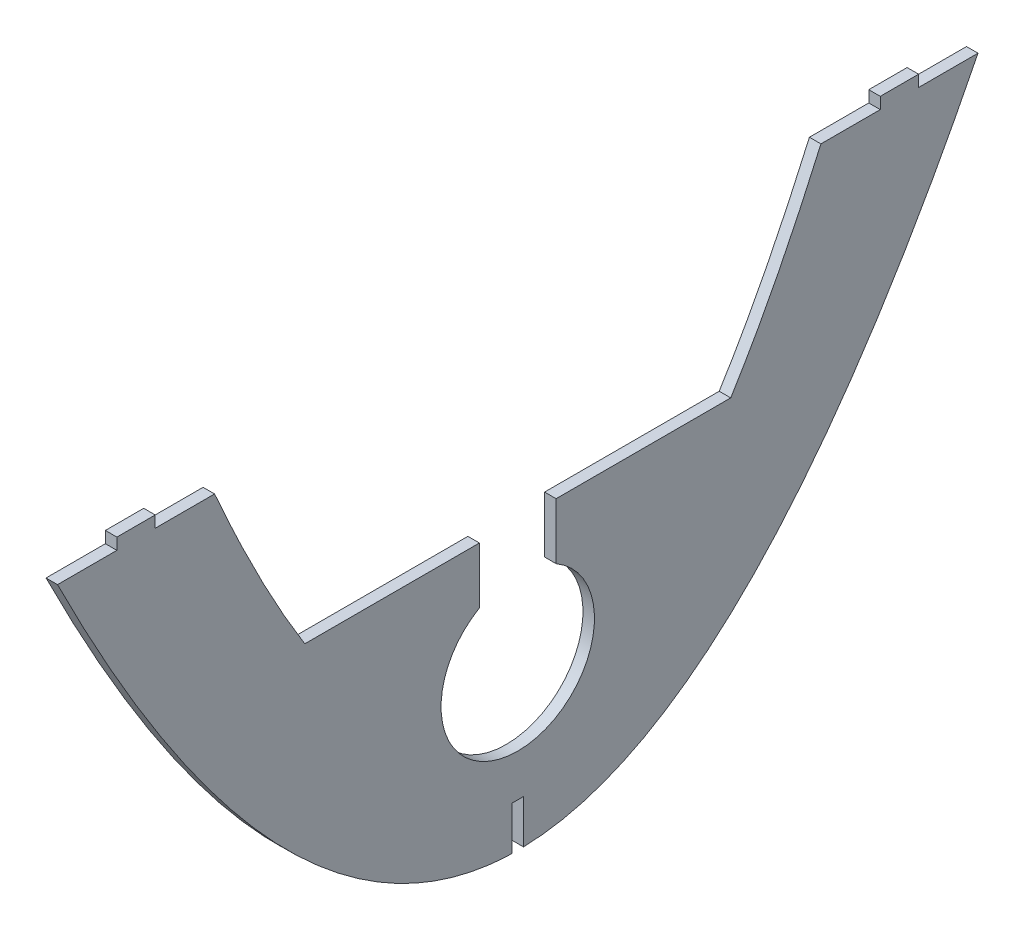
from build123d import *
from build123d.topology import SkipClean

# Parameters (mm, degrees)
EXTRUDE_1_DEPTH          = 3
SKETCH_2_W               = 3
SKETCH_2_H               = 10
EXTRUDE_2_DEPTH          = 3
EXTRUDE_3_DEPTH          = 3
CUT_EXTRUDE_1_DEPTH      = 172.862791995
CUT_EXTRUDE_1_DEPTH_BACK = 3
SKETCH_4_W               = 3
SKETCH_4_H               = 15.330567524
CUT_EXTRUDE_2_DEPTH      = 172.862791995


with BuildPart() as part:
    # 草图1 → 凸台-拉伸1 (new body)
    with BuildSketch(Plane(origin=(0, 0, 0), x_dir=(0, 0, -1), z_dir=(1, 0, 0))):
        with BuildLine():
            Line((-120, 119.995200001), (-79.04385574, 119.995200001))
            add(Edge.make_bspline(
                [(-79.04385574, 119.995200001), (0, -59.995200001), (79.04385574, 119.995200001)],
                knots=[0.203375214, 0.203375214, 0.203375214, 0.796624786, 0.796624786, 0.796624786], degree=2))
            Line((79.04385574, 119.995200001), (120, 119.995200001))
            add(Edge.make_bspline(
                [(-120, 119.995200001), (0, -119.995200001), (120, 119.995200001)],
                knots=[0.056028977, 0.056028977, 0.056028977, 0.943971023, 0.943971023, 0.943971023], degree=2))
        make_face()
    extrude(amount=EXTRUDE_1_DEPTH)

    # 草图2 → 凸台-拉伸2 (add)
    with BuildSketch(Plane(origin=(0, 119.995200001, 0), x_dir=(1, 0, 0), z_dir=(0, 1, 0))):
        with Locations((1.5, -99.52192787)):
            Rectangle(SKETCH_2_W, SKETCH_2_H)
        with Locations((1.5, 99.52192787)):
            Rectangle(SKETCH_2_W, SKETCH_2_H)
    extrude(amount=EXTRUDE_2_DEPTH)

    # 草图3 → 凸台-拉伸3 (add)
    with BuildSketch(Plane(origin=(3, 0, 0), x_dir=(0, 0, -1), z_dir=(1, 0, 0))):
        with BuildLine():
            ThreePointArc((10, 59.720508076), (18.900244528, 48.940700022), (18.566840065, 34.96545563))
            add(Edge.make_bspline(
                [(55.520060246, 74.4), (37.043450156, 44.848105266), (18.566840065, 34.96545563)],
                knots=[0, 0, 0, 1, 1, 1], degree=2))
            Line((55.520060246, 74.4), (10, 74.4))
            Line((10, 74.4), (10, 59.720508076))
        make_face()
        with BuildLine():
            Line((-10, 74.4), (-55.520060246, 74.4))
            add(Edge.make_bspline(
                [(-18.566840065, 34.96545563), (-37.043450156, 44.848105266), (-55.520060246, 74.4)],
                knots=[0, 0, 0, 1, 1, 1], degree=2))
            ThreePointArc((-18.566840065, 34.96545563), (-18.900244528, 48.940700022), (-10, 59.720508076))
            Line((-10, 59.720508076), (-10, 74.4))
        make_face()
    extrude(amount=-EXTRUDE_3_DEPTH)

    # 草图3<3> → 切除-拉伸1 (cut, two sides: drawn at the far end of the back side and taken through both)
    with SkipClean():  # the faces are left unmerged after this step: merging them gives an invalid solid
        with BuildSketch(Plane(origin=(3, 0, 0), x_dir=(0, 0, -1), z_dir=(1, 0, 0)).offset(-CUT_EXTRUDE_1_DEPTH_BACK)):
            with BuildLine():
                add(Edge.make_bspline(
                    [(18.566840065, 34.96545563), (0, 25.03454437), (-18.566840065, 34.96545563)],
                    knots=[0.430324946, 0.430324946, 0.430324946, 0.569675054, 0.569675054, 0.569675054], degree=2))
                ThreePointArc((-18.566840065, 34.96545563), (-11.209574314, 25.836623421), (0, 22.4))
                ThreePointArc((0, 22.4), (11.209574314, 25.836623421), (18.566840065, 34.96545563))
            make_face()
        extrude(amount=CUT_EXTRUDE_1_DEPTH + CUT_EXTRUDE_1_DEPTH_BACK, mode=Mode.SUBTRACT)

    # 草图4 → 切除-拉伸2 (cut, through all)
    with SkipClean():  # the faces are left unmerged after this step: merging them gives an invalid solid
        with BuildSketch(Plane.ZY):
            with Locations((0, 3.734716238)):
                Rectangle(SKETCH_4_W, SKETCH_4_H)
        extrude(amount=-CUT_EXTRUDE_2_DEPTH, mode=Mode.SUBTRACT)


solid = part.part
